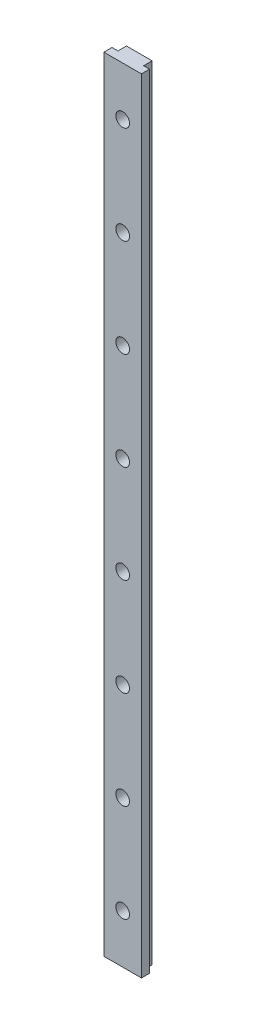
from build123d import *

# Parameters (mm, degrees)
SKETCH1_W           = 1.6637
SKETCH1_H           = 1.1049
BOSS_EXTRUDE1_DEPTH = 101.6
CUT_EXTRUDE1_REACH  = 103.652
SKETCH2_R           = 0.889


with BuildPart() as part:
    # Sketch1 → Boss-Extrude1 (new body)
    with BuildSketch(Plane(origin=(0, 0, 0), x_dir=(1, 0, 0), z_dir=(0, 1, 0))):
        with Locations((-0.83185, 1.60655)):
            Rectangle(SKETCH1_W, SKETCH1_H)
        with Locations((0.83185, 1.60655)):
            Rectangle(SKETCH1_W, SKETCH1_H)
        Polygon((0, 1.0541), (0, 0), (2.4384, 0), (2.4384, 1.0541), (1.6637, 1.0541), align=None)
        Polygon((-2.4384, 0), (0, 0), (0, 1.0541), (-1.6637, 1.0541), (-2.4384, 1.0541), align=None)
    extrude(amount=BOSS_EXTRUDE1_DEPTH)

    # Sketch2 → Cut-Extrude1 (cut, up to next)
    with BuildSketch(Plane(origin=(0, 0, -2.159), x_dir=(-1, 0, 0), z_dir=(0, 0, -1)), mode=Mode.PRIVATE) as cut_extrude1_sk1:
        with Locations((0, 6.35)):
            Circle(SKETCH2_R)
    cut_extrude1_tool1 = extrude(cut_extrude1_sk1.sketch, amount=-CUT_EXTRUDE1_REACH, mode=Mode.PRIVATE) & part.part
    # Sketch2 → Cut-Extrude1 (cut, up to next)
    with BuildSketch(Plane(origin=(0, 0, -2.159), x_dir=(-1, 0, 0), z_dir=(0, 0, -1)), mode=Mode.PRIVATE) as cut_extrude1_sk2:
        with Locations((0, 19.05)):
            Circle(SKETCH2_R)
    cut_extrude1_tool2 = extrude(cut_extrude1_sk2.sketch, amount=-CUT_EXTRUDE1_REACH, mode=Mode.PRIVATE) & part.part
    # Sketch2 → Cut-Extrude1 (cut, up to next)
    with BuildSketch(Plane(origin=(0, 0, -2.159), x_dir=(-1, 0, 0), z_dir=(0, 0, -1)), mode=Mode.PRIVATE) as cut_extrude1_sk3:
        with Locations((0, 31.75)):
            Circle(SKETCH2_R)
    cut_extrude1_tool3 = extrude(cut_extrude1_sk3.sketch, amount=-CUT_EXTRUDE1_REACH, mode=Mode.PRIVATE) & part.part
    # Sketch2 → Cut-Extrude1 (cut, up to next)
    with BuildSketch(Plane(origin=(0, 0, -2.159), x_dir=(-1, 0, 0), z_dir=(0, 0, -1)), mode=Mode.PRIVATE) as cut_extrude1_sk4:
        with Locations((0, 44.45)):
            Circle(SKETCH2_R)
    cut_extrude1_tool4 = extrude(cut_extrude1_sk4.sketch, amount=-CUT_EXTRUDE1_REACH, mode=Mode.PRIVATE) & part.part
    # Sketch2 → Cut-Extrude1 (cut, up to next)
    with BuildSketch(Plane(origin=(0, 0, -2.159), x_dir=(-1, 0, 0), z_dir=(0, 0, -1)), mode=Mode.PRIVATE) as cut_extrude1_sk5:
        with Locations((0, 57.15)):
            Circle(SKETCH2_R)
    cut_extrude1_tool5 = extrude(cut_extrude1_sk5.sketch, amount=-CUT_EXTRUDE1_REACH, mode=Mode.PRIVATE) & part.part
    # Sketch2 → Cut-Extrude1 (cut, up to next)
    with BuildSketch(Plane(origin=(0, 0, -2.159), x_dir=(-1, 0, 0), z_dir=(0, 0, -1)), mode=Mode.PRIVATE) as cut_extrude1_sk6:
        with Locations((0, 69.85)):
            Circle(SKETCH2_R)
    cut_extrude1_tool6 = extrude(cut_extrude1_sk6.sketch, amount=-CUT_EXTRUDE1_REACH, mode=Mode.PRIVATE) & part.part
    # Sketch2 → Cut-Extrude1 (cut, up to next)
    with BuildSketch(Plane(origin=(0, 0, -2.159), x_dir=(-1, 0, 0), z_dir=(0, 0, -1)), mode=Mode.PRIVATE) as cut_extrude1_sk7:
        with Locations((0, 82.55)):
            Circle(SKETCH2_R)
    cut_extrude1_tool7 = extrude(cut_extrude1_sk7.sketch, amount=-CUT_EXTRUDE1_REACH, mode=Mode.PRIVATE) & part.part
    # Sketch2 → Cut-Extrude1 (cut, up to next)
    with BuildSketch(Plane(origin=(0, 0, -2.159), x_dir=(-1, 0, 0), z_dir=(0, 0, -1)), mode=Mode.PRIVATE) as cut_extrude1_sk8:
        with Locations((0, 95.25)):
            Circle(SKETCH2_R)
    cut_extrude1_tool8 = extrude(cut_extrude1_sk8.sketch, amount=-CUT_EXTRUDE1_REACH, mode=Mode.PRIVATE) & part.part
    add(cut_extrude1_tool1.solids().sort_by_distance((0, 6.35, -2.159))[0], mode=Mode.SUBTRACT)
    add(cut_extrude1_tool2.solids().sort_by_distance((0, 19.05, -2.159))[0], mode=Mode.SUBTRACT)
    add(cut_extrude1_tool3.solids().sort_by_distance((0, 31.75, -2.159))[0], mode=Mode.SUBTRACT)
    add(cut_extrude1_tool4.solids().sort_by_distance((0, 44.45, -2.159))[0], mode=Mode.SUBTRACT)
    add(cut_extrude1_tool5.solids().sort_by_distance((0, 57.15, -2.159))[0], mode=Mode.SUBTRACT)
    add(cut_extrude1_tool6.solids().sort_by_distance((0, 69.85, -2.159))[0], mode=Mode.SUBTRACT)
    add(cut_extrude1_tool7.solids().sort_by_distance((0, 82.55, -2.159))[0], mode=Mode.SUBTRACT)
    add(cut_extrude1_tool8.solids().sort_by_distance((0, 95.25, -2.159))[0], mode=Mode.SUBTRACT)


solid = part.part
